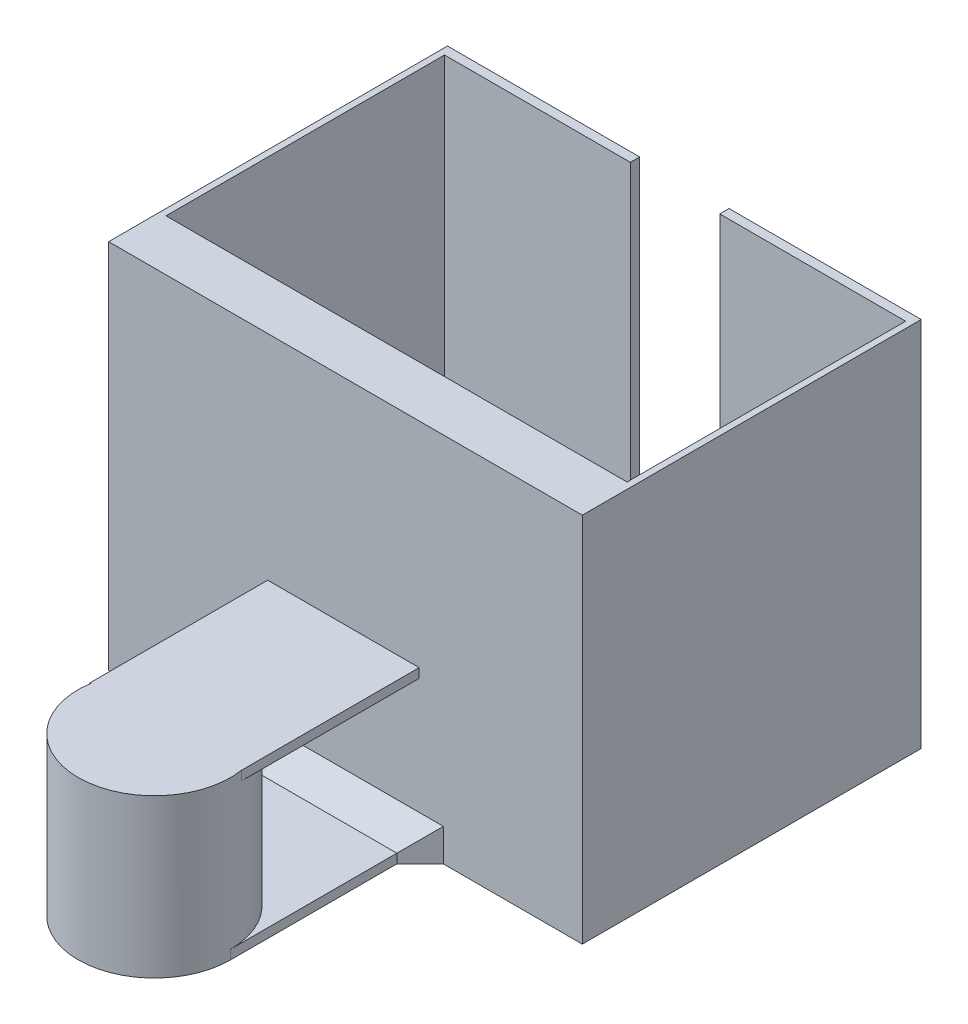
from build123d import *

# Parameters (mm, degrees)
BOSS_EXTRUDE1_DEPTH = 50.8
SKETCH3_W           = 20.832647018
SKETCH3_H           = 1.27
BOSS_EXTRUDE2_DEPTH = 25.908
SKETCH5_R           = 10.416323509
BOSS_EXTRUDE3_DEPTH = 21.59
SKETCH14_W          = 20.707274924
SKETCH14_H          = 24.296753771
BOSS_EXTRUDE7_DEPTH = 1.27
CHAMFER2_SIZE       = 3.175


with BuildPart() as part:
    # Sketch2 → Boss-Extrude1 (new body)
    with BuildSketch(Plane(origin=(0, 0, 0), x_dir=(1, 0, 0), z_dir=(0, 1, 0))):
        Polygon((66.696577012, 107.222916401), (66.696577012, 105.952916401), (41.286417012, 105.952916401), (41.286417012, 67.871966401), (104.329217012, 67.871966401), (104.329217012, 105.952916401), (78.919057012, 105.952916401), (78.919057012, 107.222916401), (105.192817012, 107.222916401), (105.192817012, 60.886966401), (40.422817012, 60.886966401), (40.422817012, 107.222916401), align=None)
    extrude(amount=BOSS_EXTRUDE1_DEPTH)

    # Sketch3 → Boss-Extrude2 (add)
    with BuildSketch(Plane.XY.offset(-60.886966401)):
        with Locations((72.594457012, 0.635)):
            Rectangle(SKETCH3_W, SKETCH3_H)
    extrude(amount=BOSS_EXTRUDE2_DEPTH)

    # Sketch5 → Boss-Extrude3 (add)
    with BuildSketch(Plane.XZ):
        with Locations(Location((72.594457012, -34.978966401, 0), (0, 0, 270))):
            Circle(SKETCH5_R)
    extrude(amount=-BOSS_EXTRUDE3_DEPTH)

    # Sketch14 → Boss-Extrude7 (add)
    with BuildSketch(Plane(origin=(0, 21.59, 0), x_dir=(1, 0, 0), z_dir=(0, 1, 0))):
        with Locations((72.531770965, 48.738589516)):
            Rectangle(SKETCH14_W, SKETCH14_H)
    extrude(amount=-BOSS_EXTRUDE7_DEPTH)

    # Chamfer2
    chamfer2_edges = [part.edges().sort_by_distance(p)[0] for p in [
        (62.178133503, 0.635, -60.886966401),
        (83.010780521, 0.635, -60.886966401),
        (72.594457012, 1.27, -60.886966401),
    ]]
    chamfer(chamfer2_edges, length=CHAMFER2_SIZE)


solid = part.part
